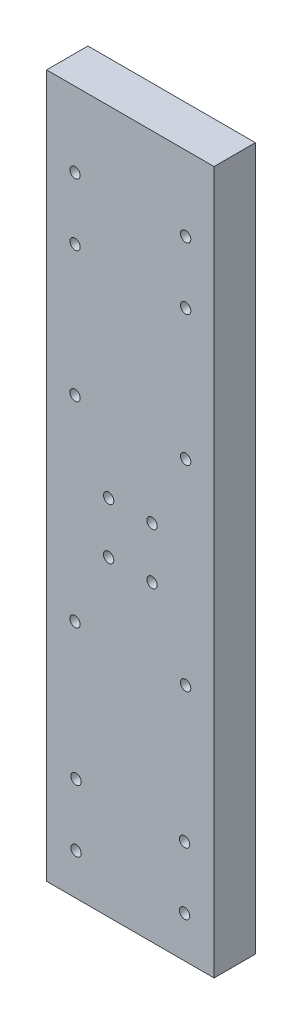
from build123d import *

# Parameters (mm, degrees)
SKETCH1_W           = 16.2
SKETCH1_H           = 67.99
SKETCH1_R           = 0.5
BOSS_EXTRUDE1_DEPTH = 4


with BuildPart() as part:
    # Sketch1 → Boss-Extrude1 (new body)
    with BuildSketch(Plane.XY):
        with Locations((8.1, 33.995)):
            Rectangle(SKETCH1_W, SKETCH1_H)
        with Locations((6, 30.15)):
            Circle(SKETCH1_R, mode=Mode.SUBTRACT)
        with Locations((10.2, 30.15)):
            Circle(SKETCH1_R, mode=Mode.SUBTRACT)
        with Locations((10.2, 35.11)):
            Circle(SKETCH1_R, mode=Mode.SUBTRACT)
        with Locations((13.45, 60.76)):
            Circle(SKETCH1_R, mode=Mode.SUBTRACT)
        with Locations((13.45, 54.76)):
            Circle(SKETCH1_R, mode=Mode.SUBTRACT)
        with Locations((2.75, 60.76)):
            Circle(SKETCH1_R, mode=Mode.SUBTRACT)
        with Locations((6, 35.11)):
            Circle(SKETCH1_R, mode=Mode.SUBTRACT)
        with Locations((2.75, 42.11)):
            Circle(SKETCH1_R, mode=Mode.SUBTRACT)
        with Locations((2.85, 10)):
            Circle(SKETCH1_R, mode=Mode.SUBTRACT)
        with Locations(Location((13.35, 10, 0), (0, 0, 180))):
            Circle(SKETCH1_R, mode=Mode.SUBTRACT)
        with Locations(Location((13.35, 4, 0), (0, 0, 180))):
            Circle(SKETCH1_R, mode=Mode.SUBTRACT)
        with Locations((2.85, 4)):
            Circle(SKETCH1_R, mode=Mode.SUBTRACT)
        with Locations((13.45, 42.11)):
            Circle(SKETCH1_R, mode=Mode.SUBTRACT)
        with Locations((2.75, 54.76)):
            Circle(SKETCH1_R, mode=Mode.SUBTRACT)
        with Locations((13.45, 23.15)):
            Circle(SKETCH1_R, mode=Mode.SUBTRACT)
        with Locations((2.75, 23.15)):
            Circle(SKETCH1_R, mode=Mode.SUBTRACT)
    extrude(amount=BOSS_EXTRUDE1_DEPTH)


solid = part.part
